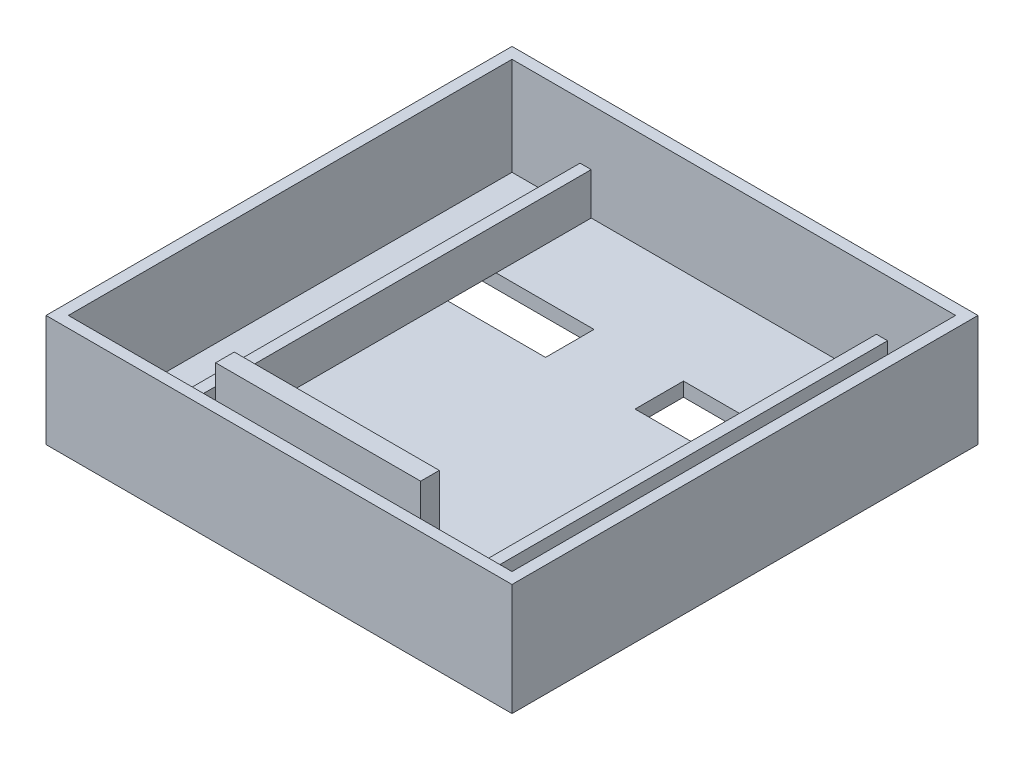
from build123d import *

# Parameters (mm, degrees)
CROQUIS1_W              = 100
CROQUIS1_H              = 100
PLACABASE_DEPTH         = 3
CROQUIS2_W              = 100
CROQUIS2_H              = 100
CROQUIS2_W_2            = 95.2
CROQUIS2_H_2            = 95.2
PAREDES_DEPTH           = 21
CROQUIS4_W              = 26.4
CROQUIS4_H              = 10.4
ALOJAMIENTOSMOTOR_DEPTH = 12.4
CROQUIS6_W              = 2.4
CROQUIS6_H              = 95.2
NERVIOSRIGIDEZ_DEPTH    = 9
CROQUIS7_W              = 95.2
CROQUIS7_H              = 6
BLOQUECUNA_DEPTH        = 10
CROQUIS8_W              = 44
CROQUIS8_H              = 4
TORRESENSORES_DEPTH     = 22


with BuildPart() as part:
    # Croquis1 → PlacaBase (new body)
    with BuildSketch(Plane(origin=(0, 0, 0), x_dir=(1, 0, 0), z_dir=(0, 1, 0))):
        with Locations((50, 50)):
            Rectangle(CROQUIS1_W, CROQUIS1_H)
    extrude(amount=PLACABASE_DEPTH)

    # Croquis2 → Paredes (add)
    with BuildSketch(Plane(origin=(0, 3, 0), x_dir=(1, 0, 0), z_dir=(0, 1, 0))):
        with Locations((50, 50)):
            Rectangle(CROQUIS2_W, CROQUIS2_H)
        with Locations((50, 50)):
            Rectangle(CROQUIS2_W_2, CROQUIS2_H_2, mode=Mode.SUBTRACT)
    extrude(amount=PAREDES_DEPTH)

    # Croquis4 → AlojamientosMotor (cut)
    with BuildSketch(Plane(origin=(0, 7.3, 0), x_dir=(1, 0, 0), z_dir=(0, 1, 0))):
        with Locations((27.2, 72)):
            Rectangle(CROQUIS4_W, CROQUIS4_H)
        with Locations((72.8, 72)):
            Rectangle(CROQUIS4_W, CROQUIS4_H)
    extrude(amount=-ALOJAMIENTOSMOTOR_DEPTH, mode=Mode.SUBTRACT)

    # Croquis6 → NerviosRigidez (add)
    with BuildSketch(Plane(origin=(0, 3, 0), x_dir=(1, 0, 0), z_dir=(0, 1, 0))):
        with Locations((18.2, 50)):
            Rectangle(CROQUIS6_W, CROQUIS6_H)
        with Locations((81.8, 50)):
            Rectangle(CROQUIS6_W, CROQUIS6_H)
    extrude(amount=NERVIOSRIGIDEZ_DEPTH)

    # Croquis7 → BloqueCuna (add)
    with BuildSketch(Plane(origin=(0, 3, 0), x_dir=(1, 0, 0), z_dir=(0, 1, 0))):
        with Locations((50, 5.4)):
            Rectangle(CROQUIS7_W, CROQUIS7_H)
    extrude(amount=BLOQUECUNA_DEPTH)

    # Croquis8 → TorreSensores (add)
    with BuildSketch(Plane(origin=(0, 3, 0), x_dir=(1, 0, 0), z_dir=(0, 1, 0))):
        with Locations((50, 10.4)):
            Rectangle(CROQUIS8_W, CROQUIS8_H)
    extrude(amount=TORRESENSORES_DEPTH)


solid = part.part
